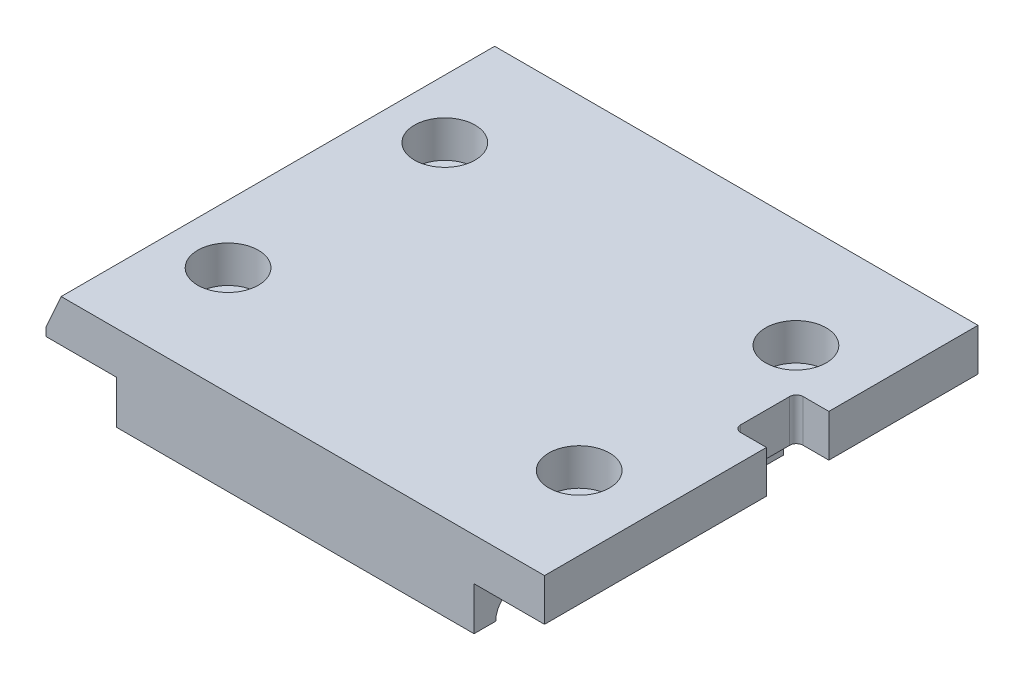
from build123d import *

# Parameters (mm, degrees)
SKETCH1_W           = 40
SKETCH1_H           = 40
SKETCH1_R           = 1.5
SKETCH1_R_2         = 2.8
BOSS_EXTRUDE1_DEPTH = 4.5
BOSS_EXTRUDE3_START = 4.5
SKETCH1_3_W         = 40
SKETCH1_3_H         = 40
SKETCH1_3_R         = 2.8
SKETCH1_3_R_2       = 1.5
BOSS_EXTRUDE3_DEPTH = 3.4
SKETCH4_W           = 3.5
SKETCH4_H           = 40
CUT_EXTRUDE2_DEPTH  = 4
SKETCH2_W           = 3
SKETCH2_H           = 40
BOSS_EXTRUDE4_DEPTH = 3.9
CUT_EXTRUDE3_START  = -39.5
SKETCH5_R           = 2
CUT_EXTRUDE3_DEPTH  = 33
CUT_EXTRUDE4_START  = -3.9
SKETCH6_W           = 3
SKETCH6_H           = 5.76
CUT_EXTRUDE4_DEPTH  = 3.9
FILLET1_R           = 0.62
CHAMFER1_SIZE       = 1.4
CHAMFER1_SIZE2      = 3.144451483


with BuildPart() as part:
    # Sketch1 → Boss-Extrude1 (new body)
    # profile 1 of 7: a face of its own
    with BuildSketch(Plane(origin=(0, 0, 0), x_dir=(1, 0, 0), z_dir=(0, 1, 0))):
        Rectangle(SKETCH1_W, SKETCH1_H)
        with Locations((0, -10)):
            Circle(SKETCH1_R, mode=Mode.SUBTRACT)
        with Locations((0, 10)):
            Circle(SKETCH1_R, mode=Mode.SUBTRACT)
        with Locations(Location((-16.2, -10, 0), (0, 0, 270))):
            Circle(SKETCH1_R, mode=Mode.SUBTRACT)
        with Locations(Location((16.2, -10, 0), (0, 0, 270))):
            Circle(SKETCH1_R, mode=Mode.SUBTRACT)
        with Locations(Location((16.2, 10, 0), (0, 0, 270))):
            Circle(SKETCH1_R, mode=Mode.SUBTRACT)
        with Locations(Location((-16.2, 10, 0), (0, 0, 270))):
            Circle(SKETCH1_R, mode=Mode.SUBTRACT)
    # profile 2 of 7: a face of its own
    with BuildSketch(Plane(origin=(0, 0, 0), x_dir=(1, 0, 0), z_dir=(0, 1, 0))):
        with Locations((0, 10)):
            Circle(SKETCH1_R)
    # profile 3 of 7: a face of its own
    with BuildSketch(Plane(origin=(0, 0, 0), x_dir=(1, 0, 0), z_dir=(0, 1, 0))):
        with Locations((0, -10)):
            Circle(SKETCH1_R)
    # profile 4 of 7: a face of its own
    with BuildSketch(Plane(origin=(0, 0, 0), x_dir=(1, 0, 0), z_dir=(0, 1, 0))):
        with Locations((-16.2, 10)):
            Circle(SKETCH1_R_2)
        with Locations(Location((-16.2, 10, 0), (0, 0, 270))):
            Circle(SKETCH1_R, mode=Mode.SUBTRACT)
    # profile 5 of 7: a face of its own
    with BuildSketch(Plane(origin=(0, 0, 0), x_dir=(1, 0, 0), z_dir=(0, 1, 0))):
        with Locations((-16.2, -10)):
            Circle(SKETCH1_R_2)
        with Locations(Location((-16.2, -10, 0), (0, 0, 270))):
            Circle(SKETCH1_R, mode=Mode.SUBTRACT)
    # profile 6 of 7: a face of its own
    with BuildSketch(Plane(origin=(0, 0, 0), x_dir=(1, 0, 0), z_dir=(0, 1, 0))):
        with Locations((16.2, 10)):
            Circle(SKETCH1_R_2)
        with Locations(Location((16.2, 10, 0), (0, 0, 270))):
            Circle(SKETCH1_R, mode=Mode.SUBTRACT)
    # profile 7 of 7: a face of its own
    with BuildSketch(Plane(origin=(0, 0, 0), x_dir=(1, 0, 0), z_dir=(0, 1, 0))):
        with Locations((16.2, -10)):
            Circle(SKETCH1_R_2)
        with Locations(Location((16.2, -10, 0), (0, 0, 270))):
            Circle(SKETCH1_R, mode=Mode.SUBTRACT)
    extrude(amount=BOSS_EXTRUDE1_DEPTH)

    # Sketch1_3 → Boss-Extrude3 (add)
    # profile 1 of 3: a face of its own
    with BuildSketch(Plane(origin=(0, 0, 0), x_dir=(1, 0, 0), z_dir=(0, 1, 0)).offset(BOSS_EXTRUDE3_START)):
        Rectangle(SKETCH1_3_W, SKETCH1_3_H)
        with Locations(Location((16.2, 10, 0), (0, 0, 270))):
            Circle(SKETCH1_3_R, mode=Mode.SUBTRACT)
        with Locations(Location((-16.2, 10, 0), (0, 0, 270))):
            Circle(SKETCH1_3_R, mode=Mode.SUBTRACT)
        with Locations((0, -10)):
            Circle(SKETCH1_3_R_2, mode=Mode.SUBTRACT)
        with Locations((0, 10)):
            Circle(SKETCH1_3_R_2, mode=Mode.SUBTRACT)
        with Locations(Location((-16.2, -10, 0), (0, 0, 270))):
            Circle(SKETCH1_3_R, mode=Mode.SUBTRACT)
        with Locations(Location((16.2, -10, 0), (0, 0, 270))):
            Circle(SKETCH1_3_R, mode=Mode.SUBTRACT)
    # profile 2 of 3: a face of its own
    with BuildSketch(Plane(origin=(0, 0, 0), x_dir=(1, 0, 0), z_dir=(0, 1, 0)).offset(BOSS_EXTRUDE3_START)):
        with Locations((0, 10)):
            Circle(SKETCH1_3_R_2)
    # profile 3 of 3: a face of its own
    with BuildSketch(Plane(origin=(0, 0, 0), x_dir=(1, 0, 0), z_dir=(0, 1, 0)).offset(BOSS_EXTRUDE3_START)):
        with Locations((0, -10)):
            Circle(SKETCH1_3_R_2)
    extrude(amount=BOSS_EXTRUDE3_DEPTH)

    # Sketch4 → Cut-Extrude2 (cut)
    with BuildSketch(Plane.XZ):
        with Locations((18.25, 0)):
            Rectangle(SKETCH4_W, SKETCH4_H)
        with Locations((-18.25, 0)):
            Rectangle(SKETCH4_W, SKETCH4_H)
    extrude(amount=-CUT_EXTRUDE2_DEPTH, mode=Mode.SUBTRACT)

    # Sketch2 → Boss-Extrude4 (add)
    with BuildSketch(Plane(origin=(0, 7.9, 0), x_dir=(1, 0, 0), z_dir=(0, 1, 0))):
        with Locations((-21.5, 0)):
            Rectangle(SKETCH2_W, SKETCH2_H)
        with Locations((21.5, 0)):
            Rectangle(SKETCH2_W, SKETCH2_H)
    extrude(amount=-BOSS_EXTRUDE4_DEPTH)

    # Sketch5 → Cut-Extrude3 (cut)
    with BuildSketch(Plane(origin=(23, 0, 0), x_dir=(0, 0, -1), z_dir=(1, 0, 0)).offset(CUT_EXTRUDE3_START)):
        with Locations((16, 0)):
            Circle(SKETCH5_R)
        with Locations((-16, 0)):
            Circle(SKETCH5_R)
    extrude(amount=CUT_EXTRUDE3_DEPTH, mode=Mode.SUBTRACT)

    # Sketch6 → Cut-Extrude4 (cut)
    with BuildSketch(Plane(origin=(0, 7.9, 0), x_dir=(1, 0, 0), z_dir=(0, 1, 0)).offset(CUT_EXTRUDE4_START)):
        with Locations((21.5, 3.36)):
            Rectangle(SKETCH6_W, SKETCH6_H)
    extrude(amount=CUT_EXTRUDE4_DEPTH, mode=Mode.SUBTRACT)

    # Fillet1
    fillet1_edges = [part.edges().sort_by_distance(p)[0] for p in [
        (20, 5.95, -0.48),
        (20, 5.95, -6.24),
    ]]
    fillet(fillet1_edges, radius=FILLET1_R)

    # Chamfer1
    chamfer1_edges = [part.edges().sort_by_distance(p)[0] for p in [
        (-23, 7.9, 0),
    ]]
    chamfer1_side = [part.faces().sort_by_distance(p)[0] for p in [
        (-0.213526435, 7.9, 0.033349354),
    ]]
    chamfer(chamfer1_edges, length=CHAMFER1_SIZE, length2=CHAMFER1_SIZE2, reference=chamfer1_side[0])


solid = part.part
